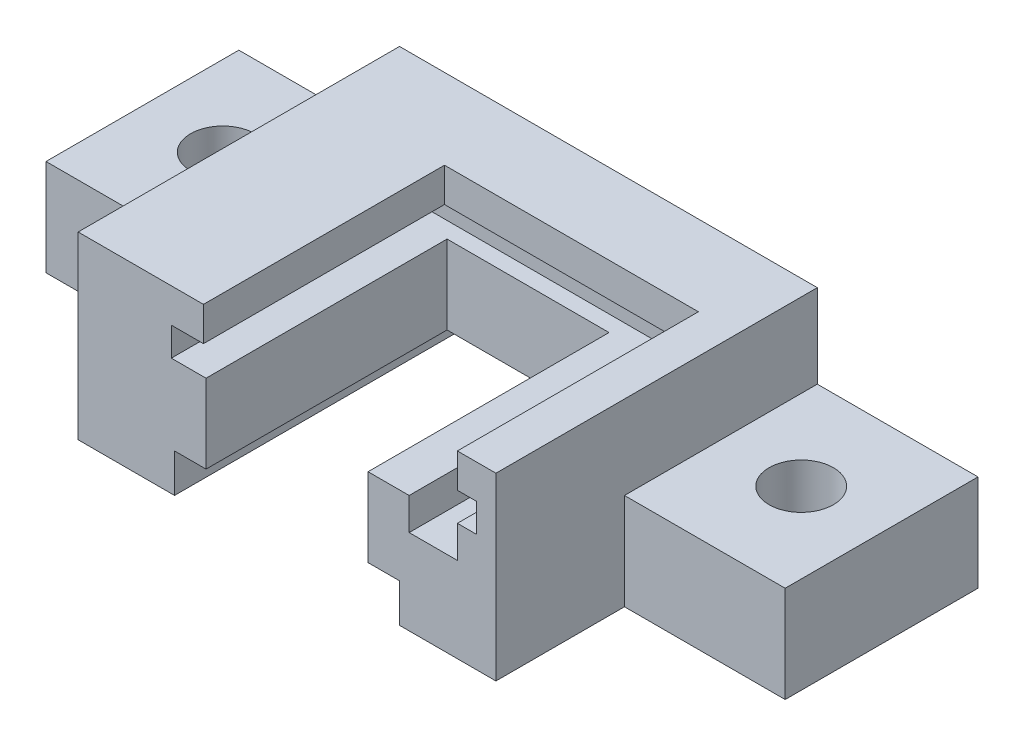
from build123d import *

# Parameters (mm, degrees)
SKETCH2_W           = 26
SKETCH2_H           = 11.2
BOSS_EXTRUDE1_DEPTH = 20
SKETCH6_W           = 14
SKETCH6_H           = 2.4
CUT_EXTRUDE1_DEPTH  = 20
SKETCH7_W           = 10.08
SKETCH7_H           = 4.9
CUT_EXTRUDE2_DEPTH  = 15
SKETCH8_W           = 19
SKETCH8_H           = 1.78
CUT_EXTRUDE3_DEPTH  = 16
SKETCH9_W           = 15.8
SKETCH9_H           = 2.12
CUT_EXTRUDE4_DEPTH  = 15
SKETCH10_W          = 3
SKETCH10_H          = 2
CUT_EXTRUDE5_DEPTH  = 15
CUT_REVOLVE3_ANGLE  = 180
SKETCH15_W          = 12
SKETCH15_H          = 6
BOSS_EXTRUDE2_DEPTH = 10
SKETCH16_W          = 12
SKETCH16_H          = 6
BOSS_EXTRUDE3_DEPTH = 10
SKETCH17_R          = 2
CUT_EXTRUDE6_DEPTH  = 12
SKETCH18_R          = 2
CUT_EXTRUDE7_DEPTH  = 12


with BuildPart() as part:
    # Sketch2 → Boss-Extrude1 (new body)
    with BuildSketch(Plane.XY):
        Rectangle(SKETCH2_W, SKETCH2_H)
    extrude(amount=BOSS_EXTRUDE1_DEPTH)

    # Sketch6 → Cut-Extrude1 (cut)
    with BuildSketch(Plane.XY.offset(20)):
        with Locations((0, -4.4)):
            Rectangle(SKETCH6_W, SKETCH6_H)
    extrude(amount=-CUT_EXTRUDE1_DEPTH, mode=Mode.SUBTRACT)

    # Sketch7 → Cut-Extrude2 (cut)
    with BuildSketch(Plane.XY.offset(20)):
        with Locations((0, -0.75)):
            Rectangle(SKETCH7_W, SKETCH7_H)
    extrude(amount=-CUT_EXTRUDE2_DEPTH, mode=Mode.SUBTRACT)

    # Sketch8 → Cut-Extrude3 (cut)
    with BuildSketch(Plane.XY.offset(20)):
        with Locations((2.3, 2.59)):
            Rectangle(SKETCH8_W, SKETCH8_H)
    extrude(amount=-CUT_EXTRUDE3_DEPTH, mode=Mode.SUBTRACT)

    # Sketch9 → Cut-Extrude4 (cut)
    with BuildSketch(Plane.XY.offset(20)):
        with Locations((2.7, 4.54)):
            Rectangle(SKETCH9_W, SKETCH9_H)
    extrude(amount=-CUT_EXTRUDE4_DEPTH, mode=Mode.SUBTRACT)

    # Sketch10 → Cut-Extrude5 (cut)
    with BuildSketch(Plane.XY.offset(20)):
        with Locations((9.1, 0.7)):
            Rectangle(SKETCH10_W, SKETCH10_H)
    extrude(amount=-CUT_EXTRUDE5_DEPTH, mode=Mode.SUBTRACT)

    # Sketch11 → Cut-Revolve3 (revolve, cut)
    with BuildSketch(Plane.XZ.offset(5.6)):
        with BuildLine():
            Line((-11.55, 5), (-8.45, 5))
            ThreePointArc((-8.45, 5), (-10, 6.55), (-11.55, 5))
        make_face()
    revolve(axis=Axis((-11.55, -5.6, 5), (-1, 0, 0)), revolution_arc=CUT_REVOLVE3_ANGLE, mode=Mode.SUBTRACT)

    # Sketch12 → Revolve2 (revolve)
    with BuildSketch(Plane.XZ.offset(5.6)):
        with BuildLine():
            Line((-11.5, 15), (-8.5, 15))
            ThreePointArc((-8.5, 15), (-10, 13.5), (-11.5, 15))
        make_face()
    revolve(axis=Axis((-11.5, -5.6, 15), (1, 0, 0)))

    # Sketch14 → Cut-Revolve4 (revolve, cut)
    with BuildSketch(Plane.XZ.offset(5.6)):
        with BuildLine():
            Line((8.45, 15), (11.55, 15))
            ThreePointArc((11.55, 15), (10, 13.45), (8.45, 15))
        make_face()
    revolve(axis=Axis((8.45, -5.6, 15), (1, 0, 0)), mode=Mode.SUBTRACT)

    # Sketch13 → Revolve3 (revolve)
    with BuildSketch(Plane.XZ.offset(5.6)):
        with BuildLine():
            Line((8.5, 5), (11.5, 5))
            ThreePointArc((11.5, 5), (10, 6.5), (8.5, 5))
        make_face()
    revolve(axis=Axis((8.5, -5.6, 5), (1, 0, 0)))

    # Sketch15 → Boss-Extrude2 (add)
    with BuildSketch(Plane.ZY.offset(13)):
        with Locations((6, -2.6)):
            Rectangle(SKETCH15_W, SKETCH15_H)
    extrude(amount=BOSS_EXTRUDE2_DEPTH)

    # Sketch16 → Boss-Extrude3 (add)
    with BuildSketch(Plane(origin=(13, 0, 0), x_dir=(0, 0, -1), z_dir=(1, 0, 0))):
        with Locations((-6, -2.6)):
            Rectangle(SKETCH16_W, SKETCH16_H)
    extrude(amount=BOSS_EXTRUDE3_DEPTH)

    # Sketch17 → Cut-Extrude6 (cut)
    with BuildSketch(Plane.XZ.offset(5.6)):
        with Locations(Location((-18, 6, 0), (0, 0, 270))):
            Circle(SKETCH17_R)
    extrude(amount=-CUT_EXTRUDE6_DEPTH, mode=Mode.SUBTRACT)

    # Sketch18 → Cut-Extrude7 (cut)
    with BuildSketch(Plane.XZ.offset(5.6)):
        with Locations(Location((18, 6, 0), (0, 0, 270))):
            Circle(SKETCH18_R)
    extrude(amount=-CUT_EXTRUDE7_DEPTH, mode=Mode.SUBTRACT)


solid = part.part
